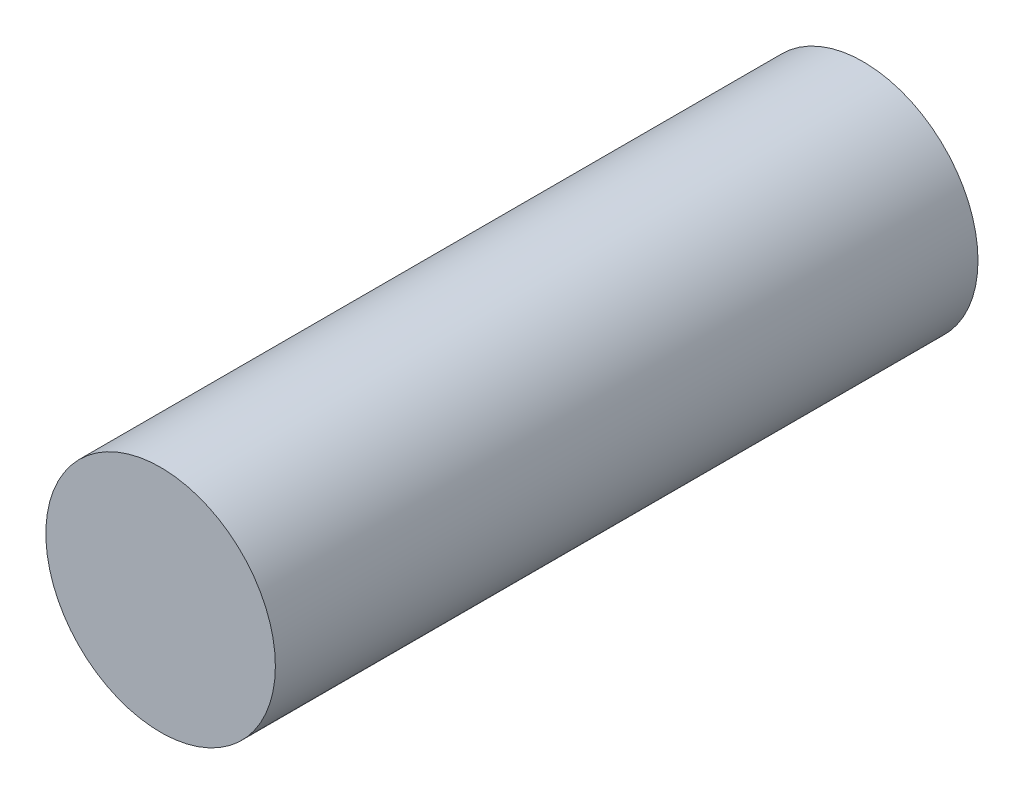
from build123d import *

# Parameters (mm, degrees)
SZKIC1_R                    = 2.45
DODANIE_WYCI_GNI_CIE1_DEPTH = 15


with BuildPart() as part:
    # Szkic1 → Dodanie-wyciągnięcie1 (new body)
    with BuildSketch(Plane.XY):
        Circle(SZKIC1_R)
    extrude(amount=DODANIE_WYCI_GNI_CIE1_DEPTH)


solid = part.part
